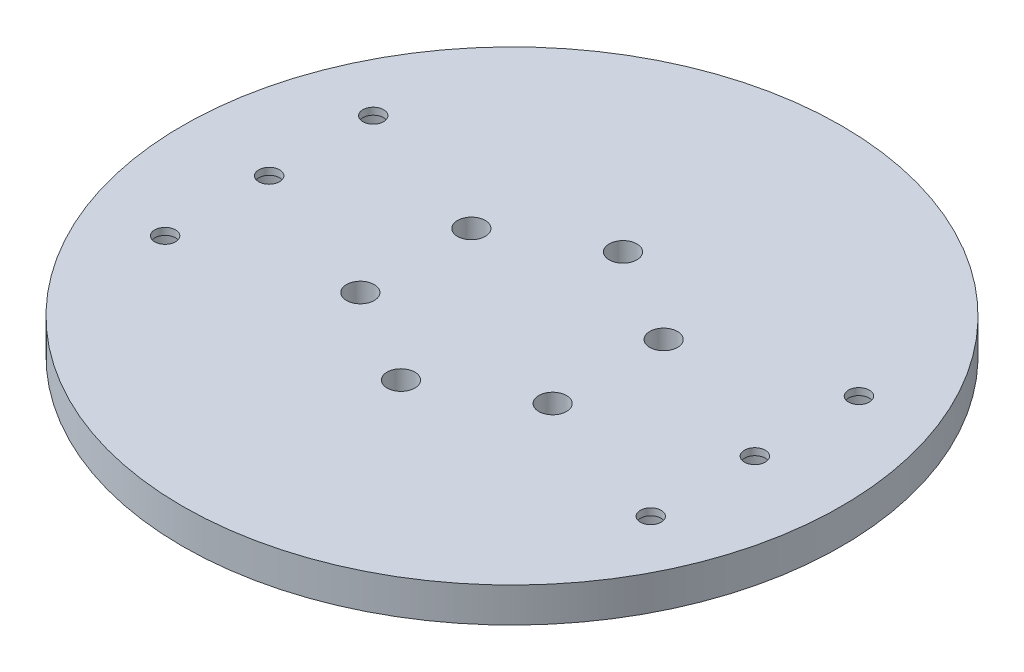
from build123d import *

# Parameters (mm, degrees)
CROQUIS1_R              = 24.5
SALIENTE_EXTRUIR1_DEPTH = 4
CROQUIS2_R              = 2
CORTAR_EXTRUIR1_DEPTH   = 35.878360053
MATRIZC1_COUNT          = 6
SALIENTE_EXTRUIR2_START = 5
CROQUIS3_R              = 47.5
CROQUIS3_R_2            = 2
SALIENTE_EXTRUIR2_DEPTH = 5
CROQUIS6_R              = 1.5
CORTAR_EXTRUIR2_DEPTH   = 68.775364256
CORTAR_EXTRUIR3_START   = -4
CROQUIS7_R              = 3.5
CROQUIS7_R_2            = 1.5
CORTAR_EXTRUIR3_DEPTH   = 4


with BuildPart() as part:
    # Croquis1 → Saliente-Extruir1 (new body)
    with BuildSketch(Plane(origin=(0, 0, 0), x_dir=(1, 0, 0), z_dir=(0, 1, 0))):
        with Locations(Location((0, 0, 0), (0, 0, 270))):
            Circle(CROQUIS1_R)
    extrude(amount=SALIENTE_EXTRUIR1_DEPTH)

    # Croquis2 → Cortar-Extruir1 (cut, through all)
    with BuildSketch(Plane(origin=(0, 4, 0), x_dir=(1, 0, 0), z_dir=(0, 1, 0))):
        with Locations(Location((0, 16, 0), (0, 0, 270))):
            Circle(CROQUIS2_R)
    cortar_extruir1 = extrude(amount=-CORTAR_EXTRUIR1_DEPTH, mode=Mode.SUBTRACT)

    # MatrizC1: Cortar-Extruir1 ×6 about axis
    matrizc1_axis = Axis((0, 0, 0), (0, 1, 0))
    for i in range(1, MATRIZC1_COUNT):
        add(cortar_extruir1.rotate(matrizc1_axis, i * 360 / MATRIZC1_COUNT), mode=Mode.SUBTRACT)

    # Croquis3 → Saliente-Extruir2 (add)
    with BuildSketch(Plane(origin=(0, 4, 0), x_dir=(1, 0, 0), z_dir=(0, 1, 0)).offset(SALIENTE_EXTRUIR2_START)):
        with Locations(Location((0, 0, 0), (0, 0, 270))):
            Circle(CROQUIS3_R)
        with Locations(Location((13.856406461, 8, 0), (0, 0, 270))):
            Circle(CROQUIS3_R_2, mode=Mode.SUBTRACT)
        with Locations(Location((13.856406461, -8, 0), (0, 0, 270))):
            Circle(CROQUIS3_R_2, mode=Mode.SUBTRACT)
        with Locations(Location((0, -16, 0), (0, 0, 270))):
            Circle(CROQUIS3_R_2, mode=Mode.SUBTRACT)
        with Locations(Location((-13.856406461, -8, 0), (0, 0, 270))):
            Circle(CROQUIS3_R_2, mode=Mode.SUBTRACT)
        with Locations(Location((-13.856406461, 8, 0), (0, 0, 270))):
            Circle(CROQUIS3_R_2, mode=Mode.SUBTRACT)
        with Locations(Location((0, 16, 0), (0, 0, 270))):
            Circle(CROQUIS3_R_2, mode=Mode.SUBTRACT)
    extrude(amount=-SALIENTE_EXTRUIR2_DEPTH)

    # Croquis6 → Cortar-Extruir2 (cut, through all)
    with BuildSketch(Plane(origin=(0, 9, 0), x_dir=(1, 0, 0), z_dir=(0, 1, 0))):
        with Locations(Location((-35, 15, 0), (0, 0, 270))):
            Circle(CROQUIS6_R)
        with Locations(Location((-35, 0, 0), (0, 0, 270))):
            Circle(CROQUIS6_R)
        with Locations(Location((-35, -15, 0), (0, 0, 270))):
            Circle(CROQUIS6_R)
    cortar_extruir2 = extrude(amount=-CORTAR_EXTRUIR2_DEPTH, mode=Mode.SUBTRACT)

    # Simetría1: Cortar-Extruir2 across plane
    add(cortar_extruir2.mirror(Plane(origin=(0, 0, 0), x_dir=(0, 0, 1), z_dir=(1, 0, 0))), mode=Mode.SUBTRACT)

    # Croquis7 → Cortar-Extruir3 (cut)
    # profile 1 of 6: a face of its own
    with BuildSketch(Plane.XZ.offset(-4).offset(CORTAR_EXTRUIR3_START)):
        with Locations(Location((35, 15, 0), (0, 0, 270))):
            Circle(CROQUIS7_R)
        with Locations(Location((35, 15, 0), (0, 0, 90))):
            Circle(CROQUIS7_R_2, mode=Mode.SUBTRACT)
    # profile 2 of 6: a face of its own
    with BuildSketch(Plane.XZ.offset(-4).offset(CORTAR_EXTRUIR3_START)):
        with Locations(Location((35, 0, 0), (0, 0, 270))):
            Circle(CROQUIS7_R)
        with Locations(Location((35, 0, 0), (0, 0, 90))):
            Circle(CROQUIS7_R_2, mode=Mode.SUBTRACT)
    # profile 3 of 6: a face of its own
    with BuildSketch(Plane.XZ.offset(-4).offset(CORTAR_EXTRUIR3_START)):
        with Locations(Location((35, -15, 0), (0, 0, 270))):
            Circle(CROQUIS7_R)
        with Locations(Location((35, -15, 0), (0, 0, 90))):
            Circle(CROQUIS7_R_2, mode=Mode.SUBTRACT)
    # profile 4 of 6: a face of its own
    with BuildSketch(Plane.XZ.offset(-4).offset(CORTAR_EXTRUIR3_START)):
        with Locations(Location((-35, 15, 0), (0, 0, 270))):
            Circle(CROQUIS7_R)
        with Locations(Location((-35, 15, 0), (0, 0, 90))):
            Circle(CROQUIS7_R_2, mode=Mode.SUBTRACT)
    # profile 5 of 6: a face of its own
    with BuildSketch(Plane.XZ.offset(-4).offset(CORTAR_EXTRUIR3_START)):
        with Locations(Location((-35, 0, 0), (0, 0, 270))):
            Circle(CROQUIS7_R)
        with Locations(Location((-35, 0, 0), (0, 0, 90))):
            Circle(CROQUIS7_R_2, mode=Mode.SUBTRACT)
    # profile 6 of 6: a face of its own
    with BuildSketch(Plane.XZ.offset(-4).offset(CORTAR_EXTRUIR3_START)):
        with Locations(Location((-35, -15, 0), (0, 0, 270))):
            Circle(CROQUIS7_R)
        with Locations(Location((-35, -15, 0), (0, 0, 90))):
            Circle(CROQUIS7_R_2, mode=Mode.SUBTRACT)
    extrude(amount=CORTAR_EXTRUIR3_DEPTH, mode=Mode.SUBTRACT)


solid = part.part
